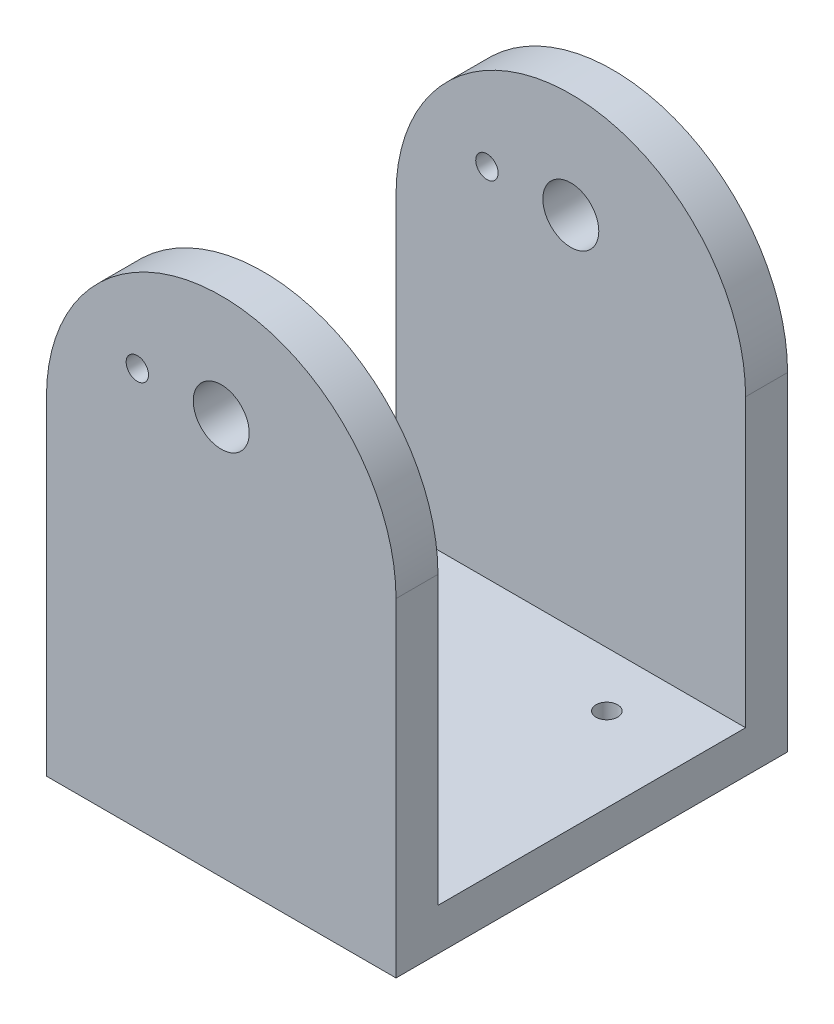
from build123d import *

# Parameters (mm, degrees)
CROQUIS1_W              = 50
CROQUIS1_H              = 56
SALIENTE_EXTRUIR1_DEPTH = 47
SALIENTE_EXTRUIR2_DEPTH = 56
CROQUIS3_W              = 44
CROQUIS3_H              = 69.477636763
CORTAR_EXTRUIR1_DEPTH   = 93.021736563
CROQUIS4_R              = 4
CROQUIS4_R_2            = 1.6
CORTAR_EXTRUIR2_DEPTH   = 95.578010129
CROQUIS5_R              = 1.55
CORTAR_EXTRUIR3_DEPTH   = 76.927597091


with BuildPart() as part:
    # Croquis1 → Saliente-Extruir1 (new body)
    with BuildSketch(Plane(origin=(0, 0, 0), x_dir=(1, 0, 0), z_dir=(0, 1, 0))):
        Rectangle(CROQUIS1_W, CROQUIS1_H)
    extrude(amount=SALIENTE_EXTRUIR1_DEPTH)

    # Croquis2 → Saliente-Extruir2 (add)
    with BuildSketch(Plane.XY.offset(28)):
        with BuildLine():
            Line((-25, 47), (25, 47))
            ThreePointArc((25, 47), (0, 72), (-25, 47))
        make_face()
    extrude(amount=-SALIENTE_EXTRUIR2_DEPTH)

    # Croquis3 → Cortar-Extruir1 (cut, through all)
    with BuildSketch(Plane.ZY.offset(25)):
        with Locations((0, 40.738818382)):
            Rectangle(CROQUIS3_W, CROQUIS3_H)
    extrude(amount=-CORTAR_EXTRUIR1_DEPTH, mode=Mode.SUBTRACT)

    # Croquis4 → Cortar-Extruir2 (cut, through all)
    with BuildSketch(Plane.XY.offset(28)):
        with Locations((0, 57)):
            Circle(CROQUIS4_R)
        with Locations((-12, 57)):
            Circle(CROQUIS4_R_2)
    extrude(amount=-CORTAR_EXTRUIR2_DEPTH, mode=Mode.SUBTRACT)

    # Croquis5 → Cortar-Extruir3 (cut, through all)
    with BuildSketch(Plane(origin=(0, 6, 0), x_dir=(1, 0, 0), z_dir=(0, 1, 0))):
        with Locations(Location((13, -14.15, 0), (0, 0, 270))):
            Circle(CROQUIS5_R)
        with Locations(Location((13, 14.15, 0), (0, 0, 270))):
            Circle(CROQUIS5_R)
        with Locations(Location((-12, 0, 0), (0, 0, 270))):
            Circle(CROQUIS5_R)
    extrude(amount=-CORTAR_EXTRUIR3_DEPTH, mode=Mode.SUBTRACT)


solid = part.part
